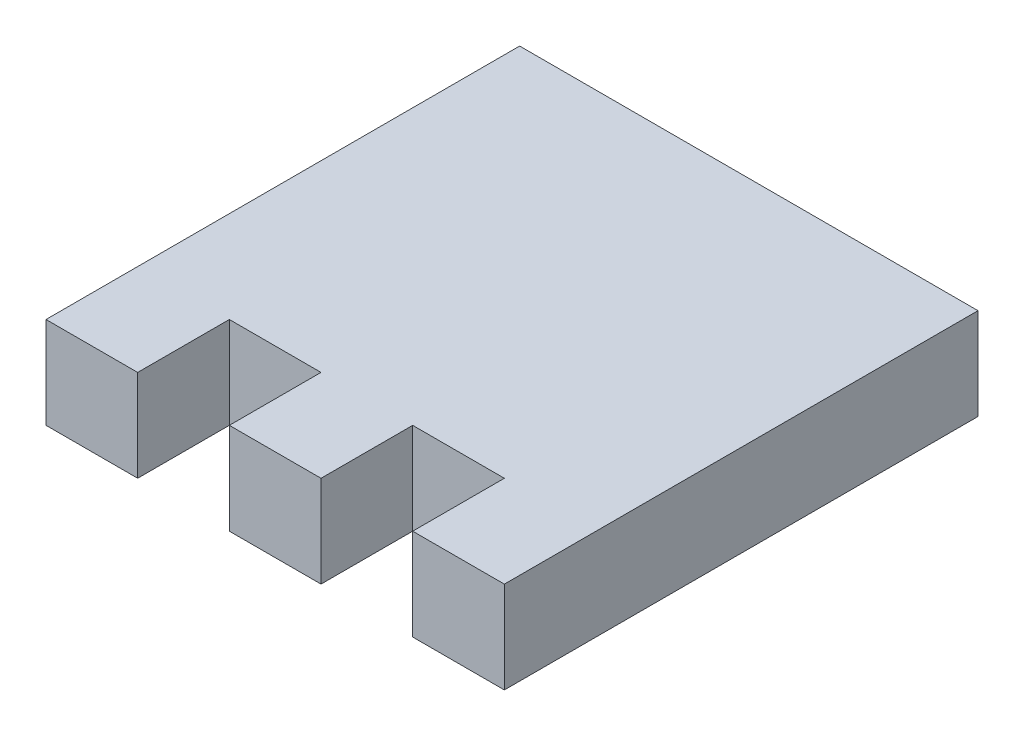
from build123d import *

# Parameters (mm, degrees)
BOSS_EXTRUDE1_DEPTH = 3


with BuildPart() as part:
    # Sketch1 → Boss-Extrude1 (new body)
    with BuildSketch(Plane(origin=(0, 0, 0), x_dir=(1, 0, 0), z_dir=(0, 1, 0))):
        Polygon((-7.5, -7.75), (-4.5, -7.75), (-4.5, -4.75), (-1.5, -4.75), (-1.5, -7.75), (1.5, -7.75), (1.5, -4.75), (4.5, -4.75), (4.5, -7.75), (7.5, -7.75), (7.5, 7.75), (-7.5, 7.75), align=None)
    extrude(amount=BOSS_EXTRUDE1_DEPTH)


solid = part.part
